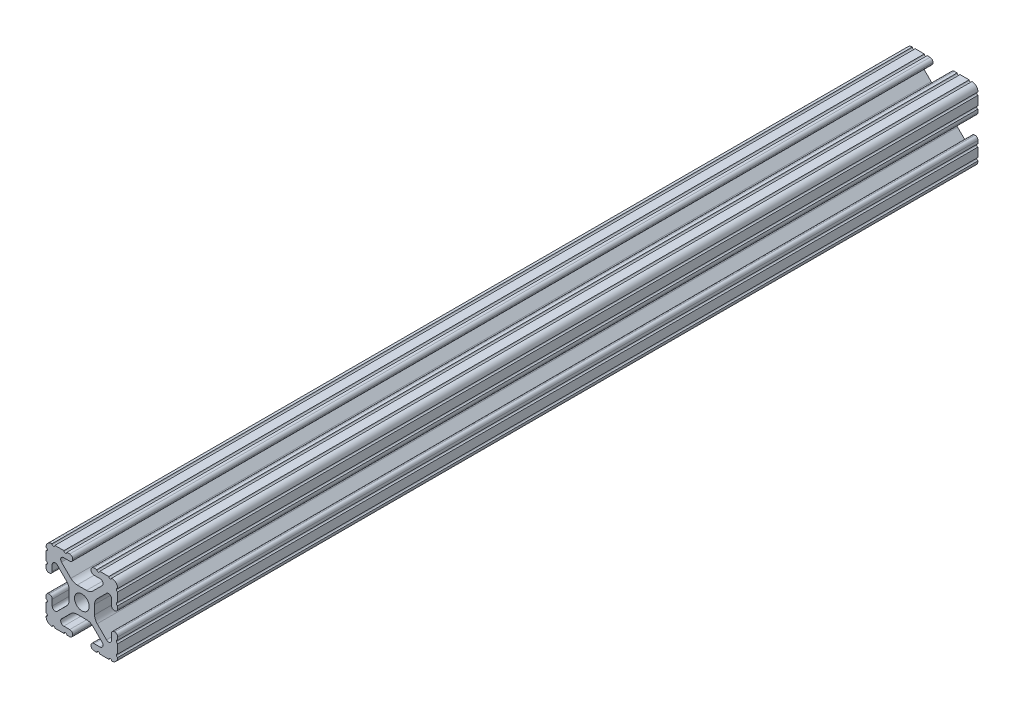
from build123d import *

# Parameters (mm, degrees)
SKETCH1_R           = 2.6035
BOSS_EXTRUDE1_DEPTH = 304.8
SKETCH2_R           = 27.881464852
CUT_EXTRUDE1_DEPTH  = 304.8


with BuildPart() as part:
    # Sketch1 → Boss-Extrude1 (new, symmetric)
    with BuildSketch(Plane.XY):
        with BuildLine():
            Line((-7.179650497, -8.645192506), (-3.952270251, -5.423690499))
            ThreePointArc((-3.952270251, -5.423690499), (-2.922936451, -4.736929036), (-1.709253557, -4.4958))
            Line((-1.709253557, -4.4958), (1.709253557, -4.4958))
            ThreePointArc((1.709253557, -4.4958), (2.922936451, -4.736929036), (3.952270251, -5.423690499))
            Line((3.952270251, -5.423690499), (7.179650497, -8.645192506))
            ThreePointArc((7.179650497, -8.645192506), (7.41473083, -9.822813117), (6.416408329, -10.4902))
            Line((6.416408329, -10.4902), (4.287512407, -10.4902))
            ThreePointArc((4.287512407, -10.4902), (3.54574862, -10.79744862), (3.2385, -11.539212407))
            Line((3.2385, -11.539212407), (3.2385, -11.650987593))
            ThreePointArc((3.2385, -11.650987593), (3.54574862, -12.39275138), (4.287512407, -12.7))
            Line((4.287512407, -12.7), (5.317126718, -12.7))
            ThreePointArc((5.317126718, -12.7), (5.825126718, -12.192), (6.333126718, -12.7))
            Line((6.333126718, -12.7), (9.550443118, -12.7))
            ThreePointArc((9.550443118, -12.7), (10.058366869, -12.192000006), (10.566443095, -12.699847501))
            ThreePointArc((10.566443095, -12.699847501), (12.082537762, -12.08250727), (12.699846982, -10.566399977))
            ThreePointArc((12.699846982, -10.566399977), (12.192000006, -10.058323491), (12.7, -9.5504))
            Line((12.7, -9.5504), (12.7, -6.3330836))
            ThreePointArc((12.7, -6.3330836), (12.192, -5.8250836), (12.7, -5.3170836))
            Line((12.7, -5.3170836), (12.7, -4.287469289))
            ThreePointArc((12.7, -4.287469289), (12.39275138, -3.545705502), (11.650987593, -3.238456882))
            Line((11.650987593, -3.238456882), (11.539212407, -3.238456882))
            ThreePointArc((11.539212407, -3.238456882), (10.79744862, -3.545705502), (10.4902, -4.287469289))
            Line((10.4902, -4.287469289), (10.4902, -6.402089023))
            ThreePointArc((10.4902, -6.402089023), (9.856505071, -7.351067942), (8.737131347, -7.129408934))
            Line((8.737131347, -7.129408934), (5.441005833, -3.840816462))
            ThreePointArc((5.441005833, -3.840816462), (4.750877967, -2.809883091), (4.5085, -1.593185507))
            Line((4.5085, -1.593185507), (4.5085, 1.593185507))
            ThreePointArc((4.5085, 1.593185507), (4.750877967, 2.809883091), (5.441005833, 3.840816462))
            Line((5.441005833, 3.840816462), (8.737131347, 7.129408934))
            ThreePointArc((8.737131347, 7.129408934), (9.856505071, 7.351067942), (10.4902, 6.402089023))
            Line((10.4902, 6.402089023), (10.4902, 4.287469289))
            ThreePointArc((10.4902, 4.287469289), (10.79744862, 3.545705502), (11.539212407, 3.238456882))
            Line((11.539212407, 3.238456882), (11.650987593, 3.238456882))
            ThreePointArc((11.650987593, 3.238456882), (12.39275138, 3.545705502), (12.7, 4.287469289))
            Line((12.7, 4.287469289), (12.7, 5.3170836))
            ThreePointArc((12.7, 5.3170836), (12.192, 5.8250836), (12.7, 6.3330836))
            Line((12.7, 6.3330836), (12.7, 9.5504))
            ThreePointArc((12.7, 9.5504), (12.192000006, 10.058323491), (12.699846982, 10.566399977))
            ThreePointArc((12.699846982, 10.566399977), (12.082537762, 12.08250727), (10.566443095, 12.699847501))
            ThreePointArc((10.566443095, 12.699847501), (10.058366869, 12.192000006), (9.550443118, 12.7))
            Line((9.550443118, 12.7), (6.333126718, 12.7))
            ThreePointArc((6.333126718, 12.7), (5.825126718, 12.192), (5.317126718, 12.7))
            Line((5.317126718, 12.7), (4.287512407, 12.7))
            ThreePointArc((4.287512407, 12.7), (3.54574862, 12.39275138), (3.2385, 11.650987593))
            Line((3.2385, 11.650987593), (3.2385, 11.539212407))
            ThreePointArc((3.2385, 11.539212407), (3.54574862, 10.79744862), (4.287512407, 10.4902))
            Line((4.287512407, 10.4902), (6.476788598, 10.4902))
            ThreePointArc((6.476788598, 10.4902), (7.432222385, 9.85140422), (7.207036008, 8.724370562))
            Line((7.207036008, 8.724370562), (3.898272566, 5.423169045))
            ThreePointArc((3.898272566, 5.423169045), (2.869120213, 4.736787962), (1.655778399, 4.4958))
            Line((1.655778399, 4.4958), (-1.655778399, 4.4958))
            ThreePointArc((-1.655778399, 4.4958), (-2.869120213, 4.736787962), (-3.898272566, 5.423169045))
            Line((-3.898272566, 5.423169045), (-7.207036008, 8.724370562))
            ThreePointArc((-7.207036008, 8.724370562), (-7.432222385, 9.85140422), (-6.476788598, 10.4902))
            Line((-6.476788598, 10.4902), (-4.287512407, 10.4902))
            ThreePointArc((-4.287512407, 10.4902), (-3.54574862, 10.79744862), (-3.2385, 11.539212407))
            Line((-3.2385, 11.539212407), (-3.2385, 11.650987593))
            ThreePointArc((-3.2385, 11.650987593), (-3.54574862, 12.39275138), (-4.287512407, 12.7))
            Line((-4.287512407, 12.7), (-5.317126718, 12.7))
            ThreePointArc((-5.317126718, 12.7), (-5.825126718, 12.192), (-6.333126718, 12.7))
            Line((-6.333126718, 12.7), (-9.550443118, 12.7))
            ThreePointArc((-9.550443118, 12.7), (-10.058366869, 12.192000006), (-10.566443095, 12.699847501))
            ThreePointArc((-10.566443095, 12.699847501), (-12.082537762, 12.08250727), (-12.699846982, 10.566399977))
            ThreePointArc((-12.699846982, 10.566399977), (-12.192000006, 10.058323491), (-12.7, 9.5504))
            Line((-12.7, 9.5504), (-12.7, 6.3330836))
            ThreePointArc((-12.7, 6.3330836), (-12.192, 5.8250836), (-12.7, 5.3170836))
            Line((-12.7, 5.3170836), (-12.7, 4.287469289))
            ThreePointArc((-12.7, 4.287469289), (-12.39275138, 3.545705502), (-11.650987593, 3.238456882))
            Line((-11.650987593, 3.238456882), (-11.539212407, 3.238456882))
            ThreePointArc((-11.539212407, 3.238456882), (-10.79744862, 3.545705502), (-10.4902, 4.287469289))
            Line((-10.4902, 4.287469289), (-10.4902, 6.402089023))
            ThreePointArc((-10.4902, 6.402089023), (-9.856505071, 7.351067942), (-8.737131347, 7.129408934))
            Line((-8.737131347, 7.129408934), (-5.441005833, 3.840816462))
            ThreePointArc((-5.441005833, 3.840816462), (-4.750877967, 2.809883091), (-4.5085, 1.593185507))
            Line((-4.5085, 1.593185507), (-4.5085, -1.593185507))
            ThreePointArc((-4.5085, -1.593185507), (-4.750877967, -2.809883091), (-5.441005833, -3.840816462))
            Line((-5.441005833, -3.840816462), (-8.737131347, -7.129408934))
            ThreePointArc((-8.737131347, -7.129408934), (-9.856505071, -7.351067942), (-10.4902, -6.402089023))
            Line((-10.4902, -6.402089023), (-10.4902, -4.287469289))
            ThreePointArc((-10.4902, -4.287469289), (-10.79744862, -3.545705502), (-11.539212407, -3.238456882))
            Line((-11.539212407, -3.238456882), (-11.650987593, -3.238456882))
            ThreePointArc((-11.650987593, -3.238456882), (-12.39275138, -3.545705502), (-12.7, -4.287469289))
            Line((-12.7, -4.287469289), (-12.7, -5.3170836))
            ThreePointArc((-12.7, -5.3170836), (-12.192, -5.8250836), (-12.7, -6.3330836))
            Line((-12.7, -6.3330836), (-12.7, -9.5504))
            ThreePointArc((-12.7, -9.5504), (-12.192000006, -10.058323491), (-12.699846982, -10.566399977))
            ThreePointArc((-12.699846982, -10.566399977), (-12.082537762, -12.08250727), (-10.566443095, -12.699847501))
            ThreePointArc((-10.566443095, -12.699847501), (-10.058366869, -12.192000006), (-9.550443118, -12.7))
            Line((-9.550443118, -12.7), (-6.333126718, -12.7))
            ThreePointArc((-6.333126718, -12.7), (-5.825126718, -12.192), (-5.317126718, -12.7))
            Line((-5.317126718, -12.7), (-4.287512407, -12.7))
            ThreePointArc((-4.287512407, -12.7), (-3.54574862, -12.39275138), (-3.2385, -11.650987593))
            Line((-3.2385, -11.650987593), (-3.2385, -11.539212407))
            ThreePointArc((-3.2385, -11.539212407), (-3.54574862, -10.79744862), (-4.287512407, -10.4902))
            Line((-4.287512407, -10.4902), (-6.416408329, -10.4902))
            ThreePointArc((-6.416408329, -10.4902), (-7.41473083, -9.822813117), (-7.179650497, -8.645192506))
        make_face()
        with Locations(Location((0, 0, 0), (0, 0, 180))):
            Circle(SKETCH1_R, mode=Mode.SUBTRACT)
    extrude(amount=BOSS_EXTRUDE1_DEPTH, both=True)

    # Sketch2 → Cut-Extrude1 (cut)
    with BuildSketch(Plane(origin=(0, 0, -304.8), x_dir=(-1, 0, 0), z_dir=(0, 0, -1))):
        Circle(SKETCH2_R)
    extrude(amount=-CUT_EXTRUDE1_DEPTH, mode=Mode.SUBTRACT)


solid = part.part
